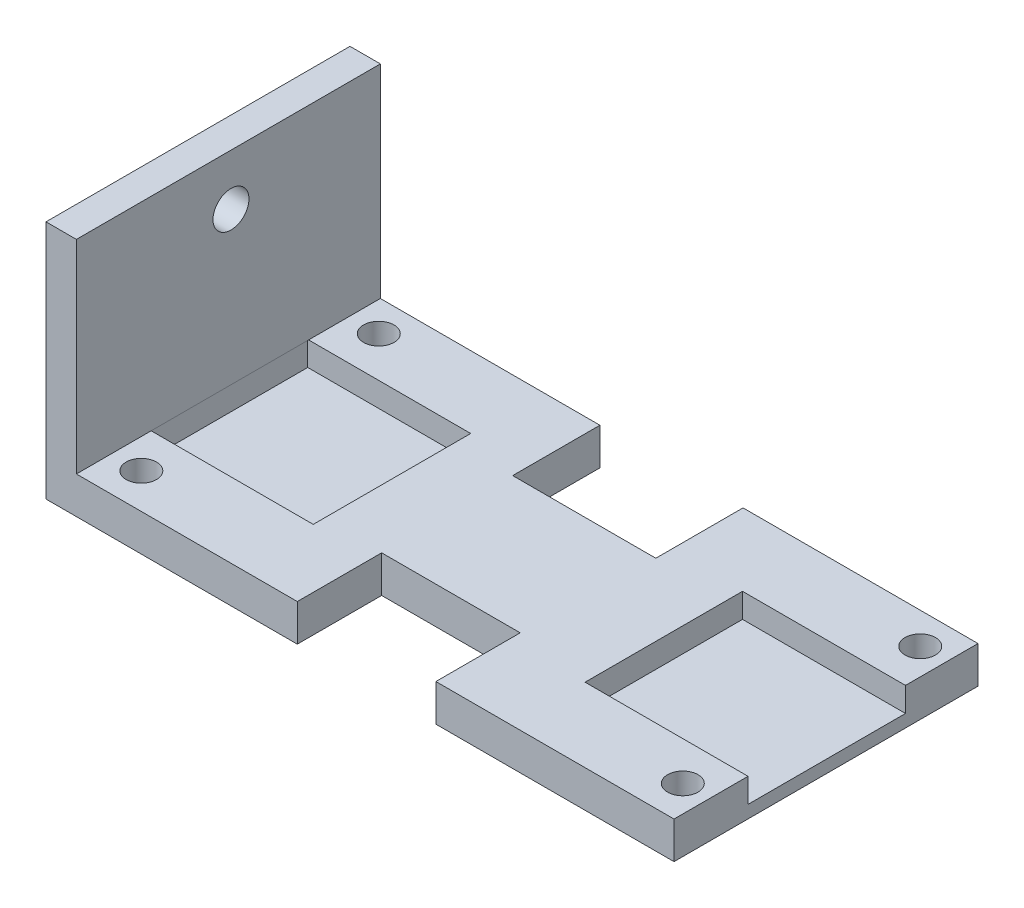
from build123d import *

# Parameters (mm, degrees)
SKETCH5_W           = 25.4
SKETCH5_H           = 25.4
BOSS_EXTRUDE2_DEPTH = 2.54
SKETCH6_W           = 25.4
SKETCH6_H           = 3.086684186
BOSS_EXTRUDE3_DEPTH = 49.9364
SKETCH7_R           = 1.27
CUT_EXTRUDE1_DEPTH  = 49.9364
SKETCH8_R           = 1.503583718
CUT_EXTRUDE2_DEPTH  = 49.9364
SKETCH9_W           = 11.960422389
SKETCH9_H           = 7.288882616
SKETCH9_W_2         = 11.577688012
SKETCH9_H_2         = 7.115600704
CUT_EXTRUDE4_DEPTH  = 5.08
SKETCH10_W          = 13.617142972
SKETCH10_H          = 13.156114308
SKETCH10_H_2        = 13.156114309
CUT_EXTRUDE5_DEPTH  = 2.032
SKETCH12_W          = 25.4
SKETCH12_H          = 5.336540019
CUT_EXTRUDE6_DEPTH  = 2.54


with BuildPart() as part:
    # Sketch5 → Boss-Extrude2 (new body)
    with BuildSketch(Plane(origin=(0, 0, 0), x_dir=(0, 0, -1), z_dir=(1, 0, 0))):
        with Locations((6.544263828, 0.143373815)):
            Rectangle(SKETCH5_W, SKETCH5_H)
    extrude(amount=-BOSS_EXTRUDE2_DEPTH)

    # Sketch6 → Boss-Extrude3 (add)
    with BuildSketch(Plane(origin=(0, 0, 0), x_dir=(0, 0, -1), z_dir=(1, 0, 0))):
        with Locations((6.544263828, -11.013284092)):
            Rectangle(SKETCH6_W, SKETCH6_H)
    extrude(amount=BOSS_EXTRUDE3_DEPTH)

    # Sketch7 → Cut-Extrude1 (cut)
    with BuildSketch(Plane(origin=(0, -9.469941999, 0), x_dir=(1, 0, 0), z_dir=(0, 1, 0))):
        with Locations(Location((2.479766783, 16.6315447, 0), (0, 0, 270))):
            Circle(SKETCH7_R)
        with Locations(Location((47.725207241, -3.210779596, 0), (0, 0, 270))):
            Circle(SKETCH7_R)
        with Locations(Location((47.723516777, 16.630771834, 0), (0, 0, 270))):
            Circle(SKETCH7_R)
        with Locations(Location((2.481517748, -3.212205223, 0), (0, 0, 270))):
            Circle(SKETCH7_R)
    extrude(amount=-CUT_EXTRUDE1_DEPTH, mode=Mode.SUBTRACT)

    # Sketch8 → Cut-Extrude2 (cut)
    with BuildSketch(Plane(origin=(0, 0, 0), x_dir=(0, 0, -1), z_dir=(1, 0, 0))):
        with Locations((6.760840433, 3.230058001)):
            Circle(SKETCH8_R)
    extrude(amount=-CUT_EXTRUDE2_DEPTH, mode=Mode.SUBTRACT)

    # Sketch9 → Cut-Extrude4 (cut)
    with BuildSketch(Plane(origin=(0, -9.469941999, 0), x_dir=(1, 0, 0), z_dir=(0, 1, 0))):
        with Locations((24.323492834, 15.59982252)):
            Rectangle(SKETCH9_W, SKETCH9_H)
        with Locations((24.247688593, -2.66541828)):
            Rectangle(SKETCH9_W_2, SKETCH9_H_2)
    extrude(amount=-CUT_EXTRUDE4_DEPTH, mode=Mode.SUBTRACT)

    # Sketch10 → Cut-Extrude5 (cut)
    with BuildSketch(Plane(origin=(0, -9.469941999, 0), x_dir=(1, 0, 0), z_dir=(0, 1, 0))):
        with Locations((6.733736813, 6.670159659)):
            Rectangle(SKETCH10_W, SKETCH10_H)
        with Locations((43.127828514, 6.607211743)):
            Rectangle(SKETCH10_W, SKETCH10_H_2)
    extrude(amount=-CUT_EXTRUDE5_DEPTH, mode=Mode.SUBTRACT)

    # Sketch12 → Cut-Extrude6 (cut)
    with BuildSketch(Plane(origin=(0, 0, 0), x_dir=(0, 0, -1), z_dir=(1, 0, 0))):
        with Locations((6.544263828, 10.175103806)):
            Rectangle(SKETCH12_W, SKETCH12_H)
    extrude(amount=-CUT_EXTRUDE6_DEPTH, mode=Mode.SUBTRACT)


solid = part.part
